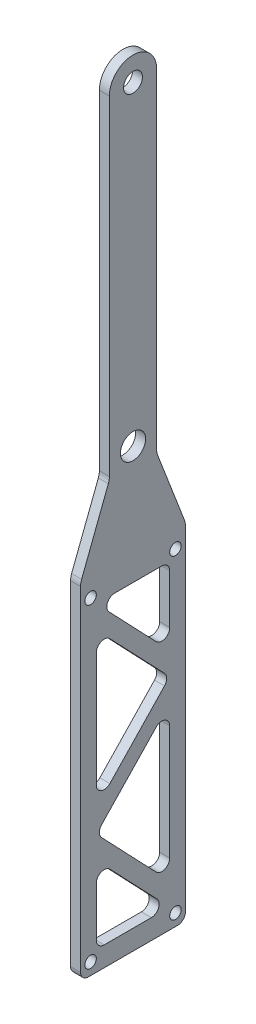
from build123d import *

# Parameters (mm, degrees)
SKETCH1_R           = 1.8288
SKETCH1_R_2         = 4
SKETCH1_R_3         = 3
BOSS_EXTRUDE1_DEPTH = 3.175
CUT_EXTRUDE1_REACH  = 146.039
SKETCH2_W           = 4.112404804
SKETCH2_H           = 133.245584328
FILLET3_R           = 2.5
FILLET4_R           = 5


with BuildPart() as part:
    # Sketch1 → Boss-Extrude1 (new body)
    with BuildSketch(Plane(origin=(0, 0, 0), x_dir=(0, 0, -1), z_dir=(1, 0, 0))):
        with BuildLine():
            Line((20.757404804, -103.81), (20.757404804, -5))
            Line((20.757404804, -5), (7.5, 29.435584328))
            Line((7.5, 29.435584328), (7.5, 135))
            ThreePointArc((7.5, 135), (0, 142.5), (-7.5, 135))
            Line((-7.5, 135), (-7.5, 29.435584328))
            Line((-7.5, 29.435584328), (-20.757404804, -5))
            Line((-20.757404804, -5), (-20.757404804, -103.81))
            Line((-20.757404804, -103.81), (20.757404804, -103.81))
        make_face()
        with Locations((-13.4747, -100)):
            Circle(SKETCH1_R, mode=Mode.SUBTRACT)
        with Locations((13.4747, -100)):
            Circle(SKETCH1_R, mode=Mode.SUBTRACT)
        with Locations((13.4747, 0)):
            Circle(SKETCH1_R, mode=Mode.SUBTRACT)
        with Locations((-13.4747, 0)):
            Circle(SKETCH1_R, mode=Mode.SUBTRACT)
        with Locations((0, 35)):
            Circle(SKETCH1_R_2, mode=Mode.SUBTRACT)
        with Locations((0, 135)):
            Circle(SKETCH1_R_3, mode=Mode.SUBTRACT)
    extrude(amount=BOSS_EXTRUDE1_DEPTH)

    # Sketch2 → Cut-Extrude1 (cut, up to next)
    with BuildSketch(Plane(origin=(3.175, 0, 0), x_dir=(0, 0, -1), z_dir=(1, 0, 0)), mode=Mode.PRIVATE) as cut_extrude1_sk1:
        Polygon((11.645, -2.5), (-11.645, -2.5), (11.645, -26.921755536), align=None)
    cut_extrude1_tool1 = extrude(cut_extrude1_sk1.sketch, amount=-CUT_EXTRUDE1_REACH, mode=Mode.PRIVATE) & part.part
    # Sketch2 → Cut-Extrude1 (cut, up to next)
    with BuildSketch(Plane(origin=(3.175, 0, 0), x_dir=(0, 0, -1), z_dir=(1, 0, 0)), mode=Mode.PRIVATE) as cut_extrude1_sk2:
        Polygon((-11.645, -9.744911131), (11.645, -34.166666667), (-11.645, -58.588422203), (-11.645, -34.166666667), align=None)
    cut_extrude1_tool2 = extrude(cut_extrude1_sk2.sketch, amount=-CUT_EXTRUDE1_REACH, mode=Mode.PRIVATE) & part.part
    # Sketch2 → Cut-Extrude1 (cut, up to next)
    with BuildSketch(Plane(origin=(3.175, 0, 0), x_dir=(0, 0, -1), z_dir=(1, 0, 0)), mode=Mode.PRIVATE) as cut_extrude1_sk3:
        Polygon((-11.645, -73.078244464), (-11.645, -97.5), (11.645, -97.5), align=None)
    cut_extrude1_tool3 = extrude(cut_extrude1_sk3.sketch, amount=-CUT_EXTRUDE1_REACH, mode=Mode.PRIVATE) & part.part
    # Sketch2 → Cut-Extrude1 (cut, up to next)
    with BuildSketch(Plane(origin=(3.175, 0, 0), x_dir=(0, 0, -1), z_dir=(1, 0, 0)), mode=Mode.PRIVATE) as cut_extrude1_sk4:
        Polygon((11.645, -41.411577797), (11.645, -65.833333333), (11.645, -90.255088869), (-11.645, -65.833333333), align=None)
    cut_extrude1_tool4 = extrude(cut_extrude1_sk4.sketch, amount=-CUT_EXTRUDE1_REACH, mode=Mode.PRIVATE) & part.part
    # Sketch2 → Cut-Extrude1 (cut, up to next)
    with BuildSketch(Plane(origin=(3.175, 0, 0), x_dir=(0, 0, -1), z_dir=(1, 0, 0)), mode=Mode.PRIVATE) as cut_extrude1_sk5:
        with Locations((-18.701202402, -37.187207836)):
            Rectangle(SKETCH2_W, SKETCH2_H)
    cut_extrude1_tool5 = extrude(cut_extrude1_sk5.sketch, amount=-CUT_EXTRUDE1_REACH, mode=Mode.PRIVATE) & part.part
    # Sketch2 → Cut-Extrude1 (cut, up to next)
    with BuildSketch(Plane(origin=(3.175, 0, 0), x_dir=(0, 0, -1), z_dir=(1, 0, 0)), mode=Mode.PRIVATE) as cut_extrude1_sk6:
        with Locations((18.701202402, -37.187207836)):
            Rectangle(SKETCH2_W, SKETCH2_H)
    cut_extrude1_tool6 = extrude(cut_extrude1_sk6.sketch, amount=-CUT_EXTRUDE1_REACH, mode=Mode.PRIVATE) & part.part
    add(cut_extrude1_tool1.solids().sort_by_distance((3.175, -10.640585, -3.881667))[0], mode=Mode.SUBTRACT)
    add(cut_extrude1_tool2.solids().sort_by_distance((3.175, -34.166667, 3.881667))[0], mode=Mode.SUBTRACT)
    add(cut_extrude1_tool3.solids().sort_by_distance((3.175, -89.359415, 3.881667))[0], mode=Mode.SUBTRACT)
    add(cut_extrude1_tool4.solids().sort_by_distance((3.175, -65.833333, -3.881667))[0], mode=Mode.SUBTRACT)
    add(cut_extrude1_tool5.solids().sort_by_distance((3.175, -37.187208, 18.701202))[0], mode=Mode.SUBTRACT)
    add(cut_extrude1_tool6.solids().sort_by_distance((3.175, -37.187208, -18.701202))[0], mode=Mode.SUBTRACT)

    # Fillet3
    fillet3_edges = [part.edges().sort_by_distance(p)[0] for p in [
        (1.5875, -26.921755536, -11.645),
        (1.5875, -2.5, 11.645),
        (1.5875, -2.5, -11.645),
        (1.5875, -103.81, 16.645),
        (1.5875, -9.744911131, 11.645),
        (1.5875, -34.166666667, -11.645),
        (1.5875, -58.588422203, 11.645),
        (1.5875, -103.81, -16.645),
        (1.5875, -73.078244464, 11.645),
        (1.5875, -97.5, -11.645),
        (1.5875, -97.5, 11.645),
        (1.5875, -90.255088869, -11.645),
        (1.5875, -65.833333333, 11.645),
        (1.5875, -41.411577797, -11.645),
    ]]
    fillet(fillet3_edges, radius=FILLET3_R)

    # Fillet4
    fillet4_edges = [part.edges().sort_by_distance(p)[0] for p in [
        (1.5875, 29.435584328, -7.5),
        (1.5875, 29.435584328, 7.5),
        (1.5875, 5.681808734, 16.645),
        (1.5875, 5.681808734, -16.645),
    ]]
    fillet(fillet4_edges, radius=FILLET4_R)


solid = part.part
